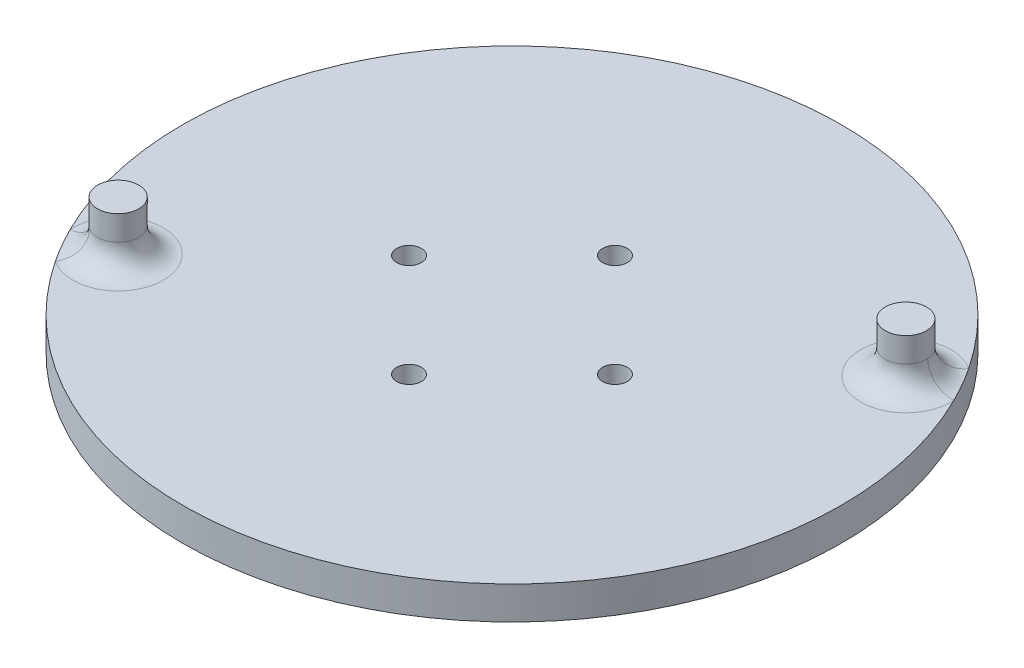
from build123d import *

# Parameters (mm, degrees)
SKETCH1_R           = 40
SKETCH1_R_2         = 1.5
BOSS_EXTRUDE1_DEPTH = 4
SKETCH2_R           = 2.5
BOSS_EXTRUDE2_DEPTH = 6
FILLET1_R           = 3


with BuildPart() as part:
    # Sketch1 → Boss-Extrude1 (new body)
    with BuildSketch(Plane(origin=(0, 0, 0), x_dir=(1, 0, 0), z_dir=(0, 1, 0))):
        with Locations(Location((0, 0, 0), (0, 0, 270))):
            Circle(SKETCH1_R)
        with Locations(Location((0, -12.5, 0), (0, 0, 270))):
            Circle(SKETCH1_R_2, mode=Mode.SUBTRACT)
        with Locations(Location((-12.5, 0, 0), (0, 0, 270))):
            Circle(SKETCH1_R_2, mode=Mode.SUBTRACT)
        with Locations(Location((0, 12.5, 0), (0, 0, 270))):
            Circle(SKETCH1_R_2, mode=Mode.SUBTRACT)
        with Locations(Location((12.5, 0, 0), (0, 0, 270))):
            Circle(SKETCH1_R_2, mode=Mode.SUBTRACT)
    extrude(amount=BOSS_EXTRUDE1_DEPTH)

    # Sketch2 → Boss-Extrude2 (add)
    with BuildSketch(Plane(origin=(0, 4, 0), x_dir=(1, 0, 0), z_dir=(0, 1, 0))):
        with Locations(Location((30.310889132, 17.5, 0), (0, 0, 270))):
            Circle(SKETCH2_R)
        with Locations(Location((-30.310889132, -17.5, 0), (0, 0, 270))):
            Circle(SKETCH2_R)
    extrude(amount=BOSS_EXTRUDE2_DEPTH)

    # Fillet1
    fillet1_edges = [part.edges().sort_by_distance(p)[0] for p in [
        (30.310889132, 4, -20),
        (-30.310889132, 4, 15),
    ]]
    fillet(fillet1_edges, radius=FILLET1_R)


solid = part.part
